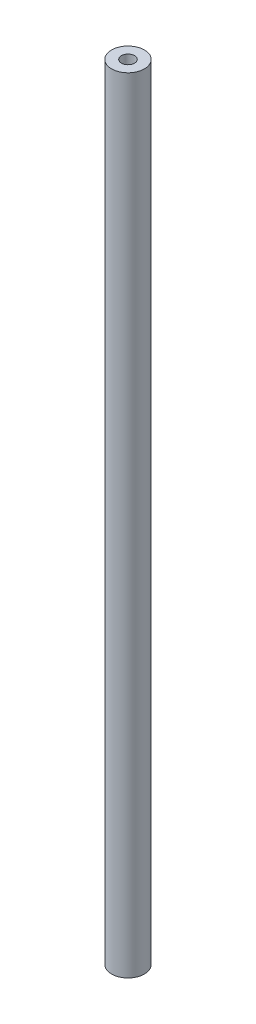
from build123d import *

# Parameters (mm, degrees)
SKETCH_1_R          = 5
EXTRUDE_1_DEPTH     = 238.84
SKETCH_2_R          = 2
CUT_EXTRUDE_1_DEPTH = 10
CUT_EXTRUDE_START   = -10
SKETCH_3_R          = 2
CUT_EXTRUDE_2_DEPTH = 10


with BuildPart() as part:
    # 스케치1 → 보스-돌출1 (new body)
    with BuildSketch(Plane(origin=(0, 0, 0), x_dir=(1, 0, 0), z_dir=(0, 1, 0))):
        with Locations(Location((0, 0, 0), (0, 0, 270))):
            Circle(SKETCH_1_R)
    extrude(amount=EXTRUDE_1_DEPTH)

    # 스케치2 → 컷-돌출1 (cut)
    with BuildSketch(Plane(origin=(0, 238.84, 0), x_dir=(1, 0, 0), z_dir=(0, 1, 0))):
        with Locations(Location((0, 0, 0), (0, 0, 270))):
            Circle(SKETCH_2_R)
    extrude(amount=-CUT_EXTRUDE_1_DEPTH, mode=Mode.SUBTRACT)

    # 스케치3 → 컷-돌출2 (cut)
    with BuildSketch(Plane.XZ.offset(CUT_EXTRUDE_START)):
        with Locations(Location((0, 0, 0), (0, 0, 90))):
            Circle(SKETCH_3_R)
    extrude(amount=CUT_EXTRUDE_2_DEPTH, mode=Mode.SUBTRACT)


solid = part.part
